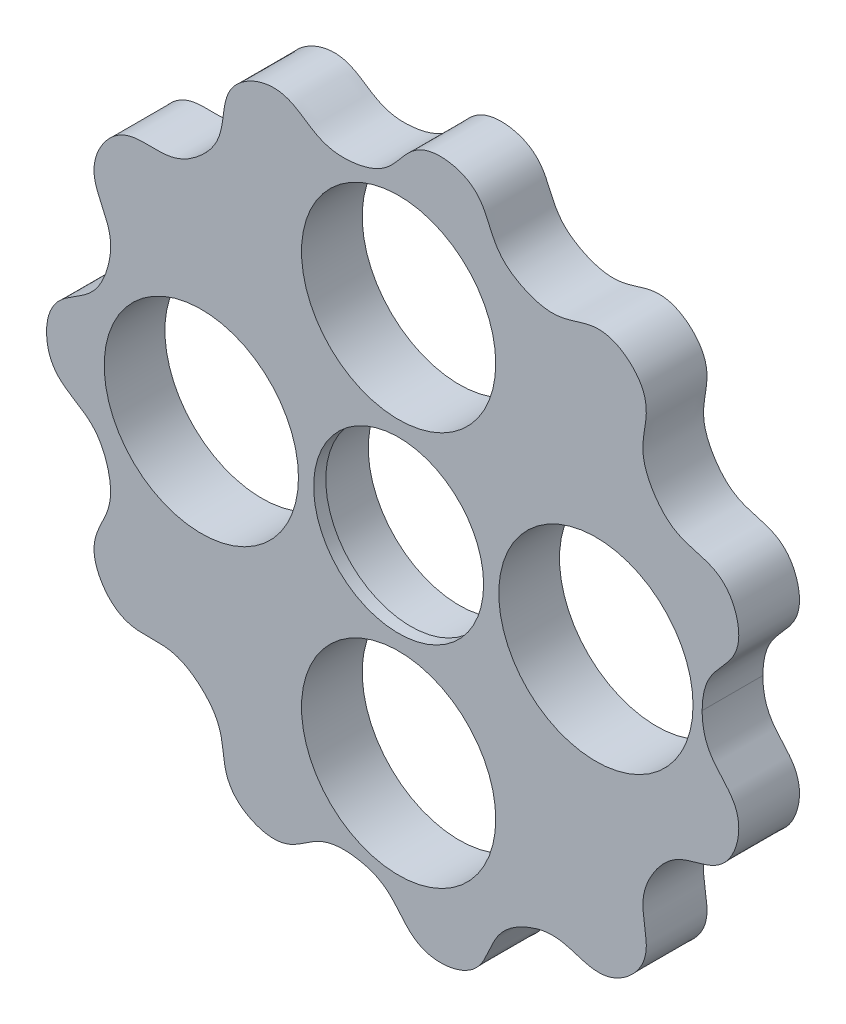
from build123d import *

# Parameters (mm, degrees)
SKETCH2_R           = 7.5
SKETCH2_R_2         = 8
BOSS_EXTRUDE2_DEPTH = 5
BOSS_EXTRUDE3_START = -1
SKETCH3_R           = 7.5
SKETCH3_R_2         = 7
BOSS_EXTRUDE3_DEPTH = 1


with BuildPart() as part:
    # Sketch2 → Boss-Extrude2 (new body)
    with BuildSketch(Plane.XY):
        with BuildLine():
            add(Edge.make_bspline(
                [(-27, 1.4e-07), (-27.000000046, -0.38122265), (-26.950846147, -0.889519693), (-26.807477288, -1.501449368), (-26.501188779, -2.153742987), (-25.894005039, -2.863646577), (-25.332006546, -3.301823769), (-24.707901453, -3.680196711), (-23.875741787, -4.183328829), (-23.050204901, -4.85610529), (-22.36490028, -5.829446295), (-21.927654739, -7.029204359), (-21.682063873, -8.263304556), (-21.701910095, -9.337201224), (-21.949393075, -10.246775757), (-22.241031593, -10.907239434), (-22.57024729, -11.560861227), (-22.856876634, -12.223279798), (-23.030008511, -12.787269172), (-23.141127016, -13.597061561), (-23.014473352, -14.549510135), (-22.594227217, -15.495282686), (-21.978098658, -16.341186043), (-21.219206278, -16.965315068), (-20.588674801, -17.287985044), (-19.917726058, -17.489690486), (-19.208046365, -17.554469273), (-18.478451893, -17.535360159), (-17.506380875, -17.508722349), (-16.448164637, -17.628378986), (-15.345421828, -18.076701895), (-14.328949291, -18.849609818), (-13.455140168, -19.755024522), (-12.8912435, -20.669173566), (-12.607686312, -21.568155755), (-12.495954623, -22.281444843), (-12.419533871, -23.00929393), (-12.302531302, -23.721519416), (-12.143263428, -24.289579628), (-11.798935445, -25.030895536), (-11.177455026, -25.763672124), (-10.312598235, -26.332104409), (-9.336948027, -26.710619349), (-8.361097504, -26.8253819), (-7.656212112, -26.755938103), (-6.982723917, -26.562881242), (-6.350681311, -26.233694816), (-5.747238551, -25.823170655), (-4.943881861, -25.275220233), (-3.98896245, -24.80376691), (-2.818894502, -24.584732367), (-1.545917818, -24.685397344), (-0.32131866, -24.974663785), (0.64728769, -25.438829341), (1.371857642, -26.041798695), (1.851485516, -26.581448948), (2.309279668, -27.152438386), (2.792766662, -27.688344227), (3.233867861, -28.080120174), (3.924320632, -28.517597038), (4.843312163, -28.79805025), (5.878193689, -28.808669036), (6.903603501, -28.59961974), (7.78658652, -28.168579517), (8.342029695, -27.729069863), (8.8042296, -27.202544889), (9.157966056, -26.583907613), (9.443668291, -25.912306926), (9.823250581, -25.01701428), (10.371692999, -24.104134095), (11.23759778, -23.28728402), (12.362917508, -22.683745633), (13.54950512, -22.265023758), (14.615295481, -22.131836544), (15.550832357, -22.247354551), (16.246077954, -22.442030828), (16.939899098, -22.674875505), (17.636366812, -22.864315383), (18.219254822, -22.95542097), (19.036618505, -22.950162977), (19.96134783, -22.689250899), (20.83768652, -22.138684796), (21.587295564, -21.408442939), (22.097070209, -20.568452167), (22.326721884, -19.898417866), (22.430888294, -19.205592737), (22.394009775, -18.493917577), (22.271263046, -17.774468835), (22.10655624, -16.816083054), (22.074395073, -15.751609017), (22.361218036, -14.596287537), (22.981599746, -13.480164959), (23.75344263, -12.486396006), (24.578036091, -11.798142019), (25.427513543, -11.38953253), (26.1176413, -11.177426487), (26.827206125, -10.998199864), (27.515530981, -10.781027957), (28.055142977, -10.542537803), (28.739910377, -10.096214328), (29.37678247, -9.376774703), (29.816346981, -8.439824558), (30.052159683, -7.420236769), (30.026876107, -6.437986584), (29.857823497, -5.750158792), (29.570884313, -5.111000591), (29.155099489, -4.532239381), (28.662875013, -3.993362478), (28.006172359, -3.276164276), (27.40361855, -2.398059371), (27.135292367, -1.609168837), (27.026017294, -0.87403381), (26.999999972, -0.249723955), (27, 0)],
                knots=[0.5, 0.5, 0.5, 0.5, 0.5, 0.5, 0.509090909, 0.512121212, 0.515151515, 0.518181818, 0.524242424, 0.527272727, 0.53030303, 0.539393939, 0.545454545, 0.554545455, 0.557575758, 0.560606061, 0.566666667, 0.56969697, 0.572727273, 0.575757576, 0.578787879, 0.581818182, 0.590909091, 0.596969697, 0.6, 0.603030303, 0.606060606, 0.609090909, 0.615151515, 0.618181818, 0.621212121, 0.63030303, 0.636363636, 0.645454545, 0.648484848, 0.651515152, 0.657575758, 0.660606061, 0.663636364, 0.666666667, 0.66969697, 0.672727273, 0.681818182, 0.687878788, 0.690909091, 0.693939394, 0.696969697, 0.7, 0.706060606, 0.709090909, 0.712121212, 0.721212121, 0.727272727, 0.736363636, 0.739393939, 0.742424242, 0.748484848, 0.751515152, 0.754545455, 0.757575758, 0.760606061, 0.763636364, 0.772727273, 0.778787879, 0.781818182, 0.784848485, 0.787878788, 0.790909091, 0.796969697, 0.8, 0.803030303, 0.812121212, 0.818181818, 0.827272727, 0.83030303, 0.833333333, 0.839393939, 0.842424242, 0.845454545, 0.848484848, 0.851515152, 0.854545455, 0.863636364, 0.86969697, 0.872727273, 0.875757576, 0.878787879, 0.881818182, 0.887878788, 0.890909091, 0.893939394, 0.903030303, 0.909090909, 0.918181818, 0.921212121, 0.924242424, 0.93030303, 0.933333333, 0.936363636, 0.939393939, 0.942424242, 0.945454545, 0.954545455, 0.960606061, 0.963636364, 0.966666667, 0.96969697, 0.972727273, 0.978787879, 0.981818182, 0.984848485, 0.993939394, 1, 1, 1, 1, 1, 1], degree=5, weights=[1, 1, 1, 1, 1, 1, 1, 1, 1, 1, 1, 1, 1, 1, 1, 1, 1, 1, 1, 1, 1, 1, 1, 1, 1, 1, 1, 1, 1, 1, 1, 1, 1, 1, 1, 1, 1, 1, 1, 1, 1, 1, 1, 1, 1, 1, 1, 1, 1, 1, 1, 1, 1, 1, 1, 1, 1, 1, 1, 1, 1, 1, 1, 1, 1, 1, 1, 1, 1, 1, 1, 1, 1, 1, 1, 1, 1, 1, 1, 1, 1, 1, 1, 1, 1, 1, 1, 1, 1, 1, 1, 1, 1, 1, 1, 1, 1, 1, 1, 1, 1, 1, 1, 1, 1, 1, 1, 1, 1, 1, 1, 1, 1, 1]))
            add(Edge.make_bspline(
                [(27, 0), (27.000000055, 0.49944791), (27.052034907, 1.123757861), (27.215948845, 1.965040117), (27.633176826, 2.808611672), (28.33202394, 3.635931787), (28.832050628, 4.170326525), (29.293694347, 4.725159671), (29.618707334, 5.217526626), (29.95346964, 5.963211033), (30.100282111, 6.912761209), (29.963513816, 7.938620344), (29.610661309, 8.923842146), (29.058346869, 9.736494251), (28.544262983, 10.22373507), (27.957319369, 10.60629813), (27.294636983, 10.868392795), (26.589212555, 11.05560825), (25.649012505, 11.303913512), (24.66737263, 11.716857181), (23.735605812, 12.457698413), (22.978060881, 13.485671541), (22.394731967, 14.600591067), (22.111222623, 15.636578701), (22.092424044, 16.579033087), (22.186175033, 17.294907409), (22.317908642, 18.014803707), (22.406302606, 18.73114249), (22.413527257, 19.321063217), (22.291999802, 20.129359026), (21.902140729, 21.00754428), (21.232462596, 21.796609379), (20.402973058, 22.434664232), (19.498983685, 22.819706956), (18.803086525, 22.951665284), (18.102488931, 22.956172135), (17.403305959, 22.818387051), (16.708648849, 22.594501475), (15.783458276, 22.295078629), (14.734396061, 22.111754365), (13.550014924, 22.231238495), (12.356963342, 22.68646481), (11.263464828, 23.309023378), (10.46486439, 24.027274912), (9.93952071, 24.809954715), (9.631358181, 25.462872129), (9.352974223, 26.139708), (9.040053972, 26.790119916), (8.72719651, 27.290298753), (8.187963403, 27.904577755), (7.385210287, 28.432580474), (6.395240391, 28.734328943), (5.35247089, 28.822638941), (4.383816823, 28.657823939), (3.727048821, 28.39260394), (3.135232032, 28.017623687), (2.621534127, 27.523704645), (2.158193061, 26.959800126), (1.541753434, 26.207713812), (0.758338719, 25.486325773), (-0.302624094, 24.946517434), (-1.552396879, 24.684465796), (-2.80888694, 24.617005461), (-3.869028477, 24.789481108), (-4.734124352, 25.16389102), (-5.346360972, 25.54655486), (-5.946477559, 25.965439696), (-6.561362056, 26.343423559), (-7.094971596, 26.595057258), (-7.880707654, 26.820290211), (-8.841486371, 26.830473263), (-9.837439582, 26.549102095), (-10.762417098, 26.059629437), (-11.488195037, 25.397284308), (-11.897314682, 24.819091457), (-12.192453016, 24.183677683), (-12.357570398, 23.490440488), (-12.442487907, 22.765552726), (-12.554461361, 21.799585033), (-12.823499939, 20.769168826), (-13.424196232, 19.74145335), (-14.333896191, 18.845323304), (-15.354451083, 18.109262246), (-16.339546271, 17.681202206), (-17.269732513, 17.528469726), (-17.991662424, 17.519386926), (-18.722978863, 17.547327752), (-19.444606122, 17.532876355), (-20.029550483, 17.456072996), (-20.812323845, 17.220750028), (-21.626087709, 16.709880366), (-22.311816127, 15.934722919), (-22.825327833, 15.022871715), (-23.077800275, 14.073286358), (-23.109378967, 13.3656928), (-23.01413451, 12.671584887), (-22.778247768, 11.999127451), (-22.45778101, 11.343403189), (-22.029737511, 10.470242035), (-21.698982104, 9.457947524), (-21.648695048, 8.268617315), (-21.929498872, 7.022923818), (-22.390099628, 5.851956221), (-22.987387705, 4.959266533), (-23.687336755, 4.327883144), (-24.28975231, 3.929937429), (-24.9200808, 3.558063231), (-25.519339266, 3.155764791), (-25.969902744, 2.774908896), (-26.501188399, 2.153743388), (-26.807476949, 1.501449736), (-26.950845931, 0.889519995), (-26.999999954, 0.38122293), (-27, 1.4e-07)],
                knots=[0, 0, 0, 0, 0, 0, 0.012121212, 0.015151515, 0.021212121, 0.024242424, 0.027272727, 0.03030303, 0.033333333, 0.036363636, 0.045454545, 0.051515152, 0.054545455, 0.057575758, 0.060606061, 0.063636364, 0.06969697, 0.072727273, 0.075757576, 0.084848485, 0.090909091, 0.1, 0.103030303, 0.106060606, 0.112121212, 0.115151515, 0.118181818, 0.121212121, 0.124242424, 0.127272727, 0.136363636, 0.142424242, 0.145454545, 0.148484848, 0.151515152, 0.154545455, 0.160606061, 0.163636364, 0.166666667, 0.175757576, 0.181818182, 0.190909091, 0.193939394, 0.196969697, 0.203030303, 0.206060606, 0.209090909, 0.212121212, 0.215151515, 0.218181818, 0.227272727, 0.233333333, 0.236363636, 0.239393939, 0.242424242, 0.245454545, 0.251515152, 0.254545455, 0.257575758, 0.266666667, 0.272727273, 0.281818182, 0.284848485, 0.287878788, 0.293939394, 0.296969697, 0.3, 0.303030303, 0.306060606, 0.309090909, 0.318181818, 0.324242424, 0.327272727, 0.33030303, 0.333333333, 0.336363636, 0.342424242, 0.345454545, 0.348484848, 0.357575758, 0.363636364, 0.372727273, 0.375757576, 0.378787879, 0.384848485, 0.387878788, 0.390909091, 0.393939394, 0.396969697, 0.4, 0.409090909, 0.415151515, 0.418181818, 0.421212121, 0.424242424, 0.427272727, 0.433333333, 0.436363636, 0.439393939, 0.448484848, 0.454545455, 0.463636364, 0.466666667, 0.46969697, 0.475757576, 0.478787879, 0.481818182, 0.484848485, 0.487878788, 0.490909091, 0.5, 0.5, 0.5, 0.5, 0.5, 0.5], degree=5, weights=[1, 1, 1, 1, 1, 1, 1, 1, 1, 1, 1, 1, 1, 1, 1, 1, 1, 1, 1, 1, 1, 1, 1, 1, 1, 1, 1, 1, 1, 1, 1, 1, 1, 1, 1, 1, 1, 1, 1, 1, 1, 1, 1, 1, 1, 1, 1, 1, 1, 1, 1, 1, 1, 1, 1, 1, 1, 1, 1, 1, 1, 1, 1, 1, 1, 1, 1, 1, 1, 1, 1, 1, 1, 1, 1, 1, 1, 1, 1, 1, 1, 1, 1, 1, 1, 1, 1, 1, 1, 1, 1, 1, 1, 1, 1, 1, 1, 1, 1, 1, 1, 1, 1, 1, 1, 1, 1, 1, 1, 1, 1, 1, 1, 1]))
        make_face()
        with Locations((2, 0)):
            Circle(SKETCH2_R, mode=Mode.SUBTRACT)
        with Locations((18.25, 0)):
            Circle(SKETCH2_R_2, mode=Mode.SUBTRACT)
        with Locations((2, 16.25)):
            Circle(SKETCH2_R_2, mode=Mode.SUBTRACT)
        with Locations((-14.25, 0)):
            Circle(SKETCH2_R_2, mode=Mode.SUBTRACT)
        with Locations((2, -16.25)):
            Circle(SKETCH2_R_2, mode=Mode.SUBTRACT)
    extrude(amount=BOSS_EXTRUDE2_DEPTH)

    # Sketch3 → Boss-Extrude3 (add)
    with BuildSketch(Plane.XY.offset(5).offset(BOSS_EXTRUDE3_START)):
        with Locations((2, 0)):
            Circle(SKETCH3_R)
        with Locations((2, 0)):
            Circle(SKETCH3_R_2, mode=Mode.SUBTRACT)
    extrude(amount=BOSS_EXTRUDE3_DEPTH)


solid = part.part
